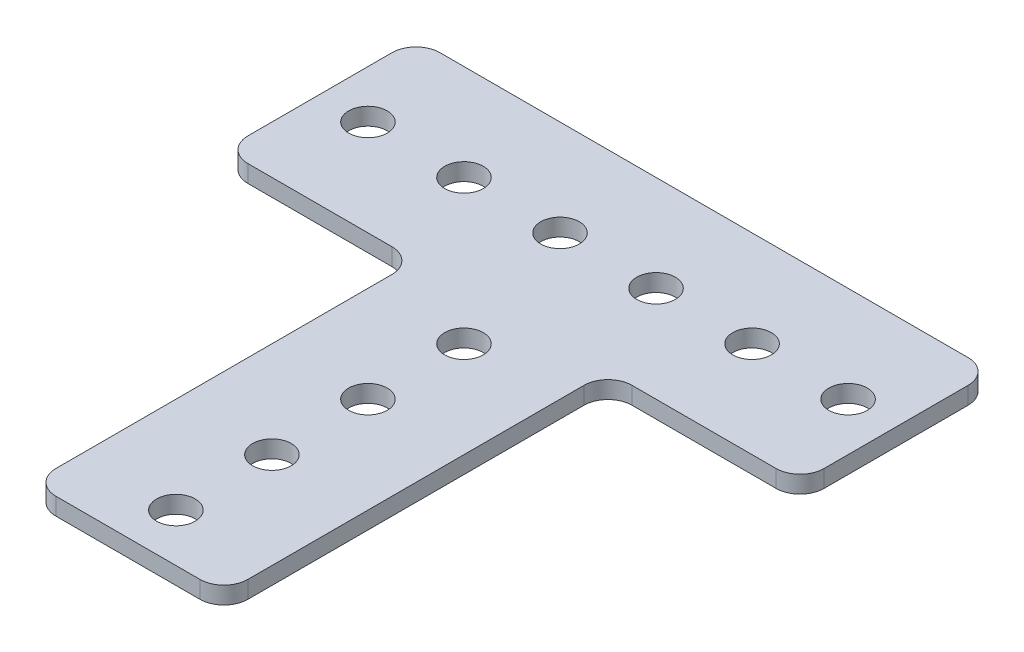
from build123d import *

# Parameters (mm, degrees)
BOSS_EXTRUDE1_DEPTH = 1.143
SKETCH2_R           = 2.5527
CUT_EXTRUDE1_DEPTH  = 75.088364782
FILLET1_R           = 3.175


with BuildPart() as part:
    # Sketch1 → Boss-Extrude1 (new, symmetric)
    with BuildSketch(Plane(origin=(0, 0, 0), x_dir=(1, 0, 0), z_dir=(0, 1, 0))):
        Polygon((12.7, -12.7), (38.1, -12.7), (38.1, 12.7), (-38.1, 12.7), (-38.1, -12.7), (-12.7, -12.7), (-12.7, -63.5), (12.7, -63.5), align=None)
    extrude(amount=BOSS_EXTRUDE1_DEPTH, both=True)

    # Sketch2 → Cut-Extrude1 (cut, through all)
    with BuildSketch(Plane(origin=(0, 1.143, 0), x_dir=(1, 0, 0), z_dir=(0, 1, 0))):
        with Locations(Location((-31.75, 0, 0), (0, 0, 270))):
            Circle(SKETCH2_R)
        with Locations(Location((-19.05, 0, 0), (0, 0, 270))):
            Circle(SKETCH2_R)
        with Locations(Location((-6.35, 0, 0), (0, 0, 270))):
            Circle(SKETCH2_R)
        with Locations(Location((6.35, 0, 0), (0, 0, 270))):
            Circle(SKETCH2_R)
        with Locations(Location((19.05, 0, 0), (0, 0, 270))):
            Circle(SKETCH2_R)
        with Locations(Location((0, -57.15, 0), (0, 0, 270))):
            Circle(SKETCH2_R)
        with Locations(Location((31.75, 0, 0), (0, 0, 270))):
            Circle(SKETCH2_R)
        with Locations(Location((0, -44.45, 0), (0, 0, 270))):
            Circle(SKETCH2_R)
        with Locations(Location((0, -31.75, 0), (0, 0, 270))):
            Circle(SKETCH2_R)
        with Locations(Location((0, -19.05, 0), (0, 0, 270))):
            Circle(SKETCH2_R)
    extrude(amount=-CUT_EXTRUDE1_DEPTH, mode=Mode.SUBTRACT)

    # Fillet1
    fillet1_edges = [part.edges().sort_by_distance(p)[0] for p in [
        (38.1, 0, 12.7),
        (12.7, 0, 12.7),
        (12.7, 0, 63.5),
        (-12.7, 0, 63.5),
        (-12.7, 0, 12.7),
        (-38.1, 0, 12.7),
        (-38.1, 0, -12.7),
        (38.1, 0, -12.7),
    ]]
    fillet(fillet1_edges, radius=FILLET1_R)


solid = part.part
